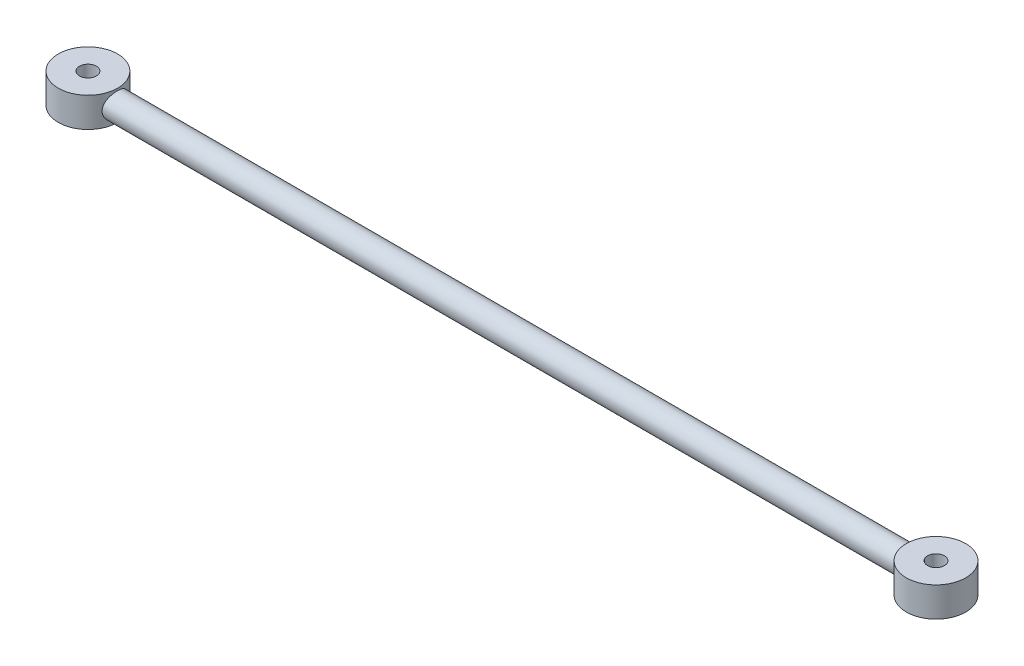
from build123d import *

# Parameters (mm, degrees)
SKETCH1_R                            = 7
SKETCH1_R_2                          = 2
BOSS_EXTRUDE1_DEPTH                  = 7
BOSS_EXTRUDE1_2_DEPTH                = 7
BOSS_EXTRUDE2_REACH                  = 186.765
BOSS_EXTRUDE2_END_RADIUS             = 7
SKETCH2_R                            = 3
BOSS_EXTRUDE2_DIRECTION_2_REACH      = 186.765
BOSS_EXTRUDE2_DIRECTION_2_END_RADIUS = 7


with BuildPart() as part:
    # Sketch1 → Boss-Extrude1 (new body)
    with BuildSketch(Plane(origin=(0, 0, 0), x_dir=(1, 0, 0), z_dir=(0, 1, 0))):
        with Locations(Location((0, 0, 0), (0, 0, 270))):
            Circle(SKETCH1_R)
        with Locations(Location((0, 0, 0), (0, 0, 270))):
            Circle(SKETCH1_R_2, mode=Mode.SUBTRACT)
    extrude(amount=BOSS_EXTRUDE1_DEPTH)



with BuildPart() as body_2:
    # Sketch1 → Boss-Extrude1 2 (new body)
    with BuildSketch(Plane(origin=(0, 0, 0), x_dir=(1, 0, 0), z_dir=(0, 1, 0))):
        with Locations(Location((200, 0, 0), (0, 0, 270))):
            Circle(SKETCH1_R)
        with Locations(Location((200, 0, 0), (0, 0, 270))):
            Circle(SKETCH1_R_2, mode=Mode.SUBTRACT)
    extrude(amount=BOSS_EXTRUDE1_2_DEPTH)


with BuildPart() as part_1:
    add(part.part)

    add(body_2.part)  # Boss-Extrude2 merges body 2
    # Boss-Extrude2: up to this cylinder (the profile starts outside it)
    boss_extrude2_end = Plane(origin=(200, 3.5, 0), z_dir=(0, -1, 0)) * Cylinder(BOSS_EXTRUDE2_END_RADIUS, 388.53, mode=Mode.PRIVATE)
    # Sketch2 → Boss-Extrude2 (add, up to the surface)
    with BuildSketch(Plane(origin=(22.5, 0, 0), x_dir=(0, 0, -1), z_dir=(1, 0, 0)), mode=Mode.PRIVATE) as boss_extrude2_sk1:
        with Locations(Location((0, 3.5, 0), (0, 0, 180))):
            Circle(SKETCH2_R)
    boss_extrude2_tool1 = extrude(boss_extrude2_sk1.sketch, amount=BOSS_EXTRUDE2_REACH, mode=Mode.PRIVATE) - boss_extrude2_end
    add(boss_extrude2_tool1.solids().sort_by_distance((22.5, 3.5, 0))[0])

    # Boss-Extrude2 direction 2: up to this cylinder (the profile starts outside it)
    boss_extrude2_direction_2_end = Plane(origin=(0, 3.5, 0), z_dir=(0, -1, 0)) * Cylinder(BOSS_EXTRUDE2_DIRECTION_2_END_RADIUS, 388.53, mode=Mode.PRIVATE)
    # Sketch2 → Boss-Extrude2 direction 2 (add, up to the surface)
    with BuildSketch(Plane(origin=(22.5, 0, 0), x_dir=(0, 0, -1), z_dir=(1, 0, 0)), mode=Mode.PRIVATE) as boss_extrude2_direction_2_sk1:
        with Locations(Location((0, 3.5, 0), (0, 0, 180))):
            Circle(SKETCH2_R)
    boss_extrude2_direction_2_tool1 = extrude(boss_extrude2_direction_2_sk1.sketch, amount=-BOSS_EXTRUDE2_DIRECTION_2_REACH, mode=Mode.PRIVATE) - boss_extrude2_direction_2_end
    add(boss_extrude2_direction_2_tool1.solids().sort_by_distance((22.5, 3.5, 0))[0])


solid = part_1.part
